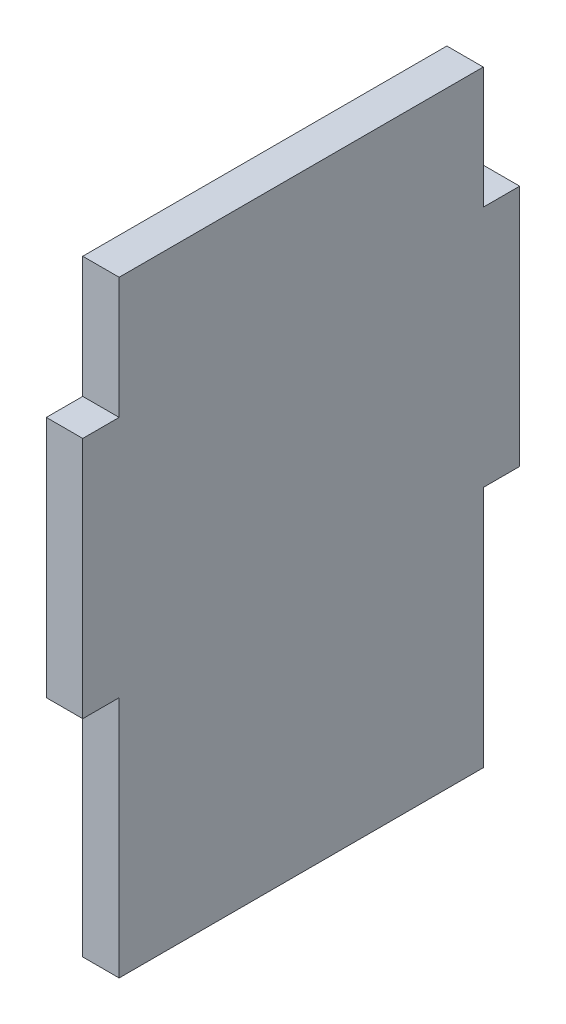
from build123d import *

# Parameters (mm, degrees)
BOSS_EXTRUDE1_DEPTH = 3


with BuildPart() as part:
    # Sketch1 → Boss-Extrude1 (new body)
    with BuildSketch(Plane(origin=(0, 0, 0), x_dir=(0, 0, -1), z_dir=(1, 0, 0))):
        Polygon((-15, 0), (15, 0), (15, 20), (18, 20), (18, 40), (15, 40), (15, 50), (-15, 50), (-15, 40), (-18, 40), (-18, 20), (-15, 20), align=None)
    extrude(amount=BOSS_EXTRUDE1_DEPTH)


solid = part.part
